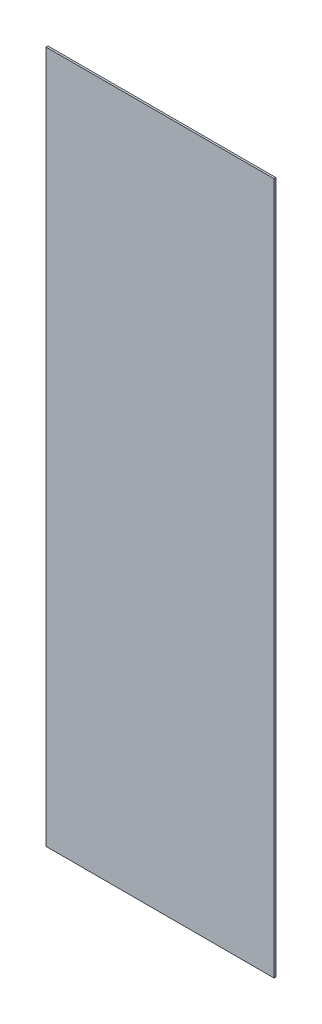
from build123d import *

# Parameters (mm, degrees)
SKETCH_1_W      = 118.499999794
SKETCH_1_H      = 359.999999959
EXTRUDE_1_DEPTH = 1


with BuildPart() as part:
    # 草图1 → 凸台-拉伸1 (new body)
    with BuildSketch(Plane.XY):
        with Locations((215.750000103, -189.99999998)):
            Rectangle(SKETCH_1_W, SKETCH_1_H)
    extrude(amount=-EXTRUDE_1_DEPTH)


solid = part.part
